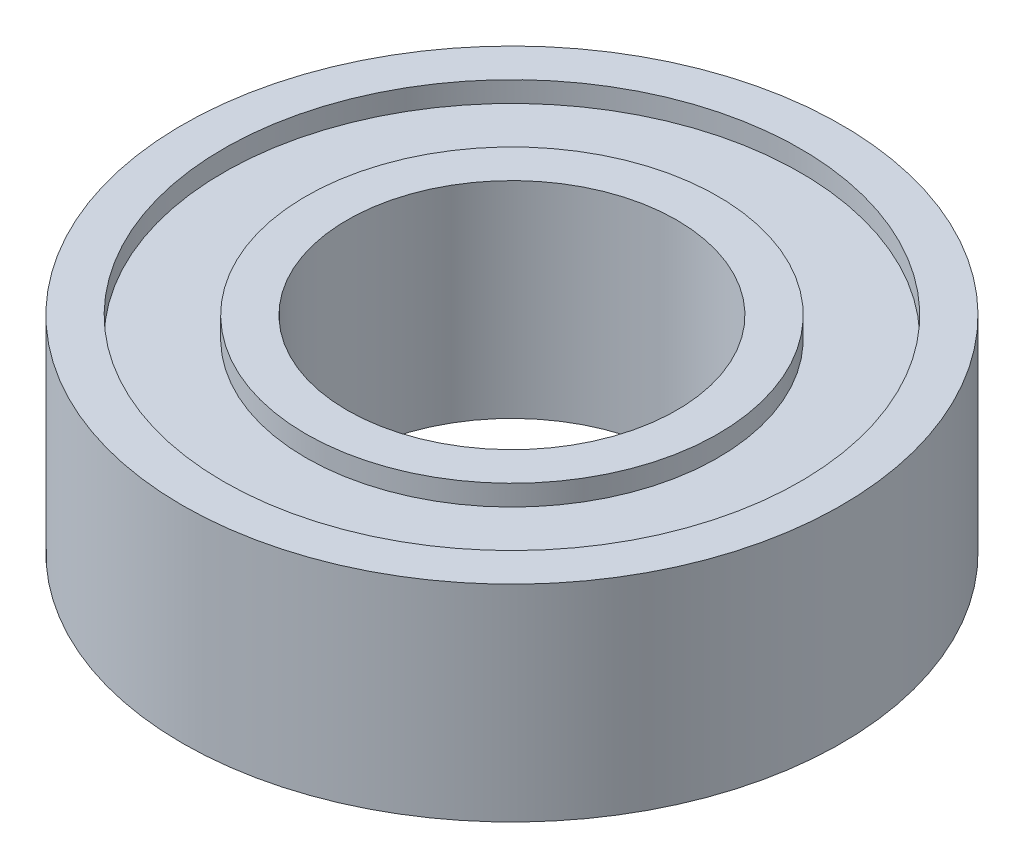
from build123d import *

# Parameters (mm, degrees)
SKETCH1_R           = 8
SKETCH1_R_2         = 4
BOSS_EXTRUDE1_DEPTH = 2.5
SKETCH2_R           = 7
SKETCH2_R_2         = 5
CUT_EXTRUDE1_DEPTH  = 0.5


with BuildPart() as part:
    # Sketch1 → Boss-Extrude1 (new, symmetric)
    with BuildSketch(Plane(origin=(0, 0, 0), x_dir=(1, 0, 0), z_dir=(0, 1, 0))):
        with Locations(Location((0, 0, 0), (0, 0, 270))):
            Circle(SKETCH1_R)
        with Locations(Location((0, 0, 0), (0, 0, 270))):
            Circle(SKETCH1_R_2, mode=Mode.SUBTRACT)
    extrude(amount=BOSS_EXTRUDE1_DEPTH, both=True)

    # Sketch2 → Cut-Extrude1 (cut)
    with BuildSketch(Plane(origin=(0, 2.5, 0), x_dir=(1, 0, 0), z_dir=(0, 1, 0))):
        with Locations(Location((0, 0, 0), (0, 0, 270))):
            Circle(SKETCH2_R)
        with Locations(Location((0, 0, 0), (0, 0, 270))):
            Circle(SKETCH2_R_2, mode=Mode.SUBTRACT)
    cut_extrude1 = extrude(amount=-CUT_EXTRUDE1_DEPTH, mode=Mode.SUBTRACT)

    # Mirror1: Cut-Extrude1 across plane
    add(cut_extrude1.mirror(Plane.ZX), mode=Mode.SUBTRACT)


solid = part.part
